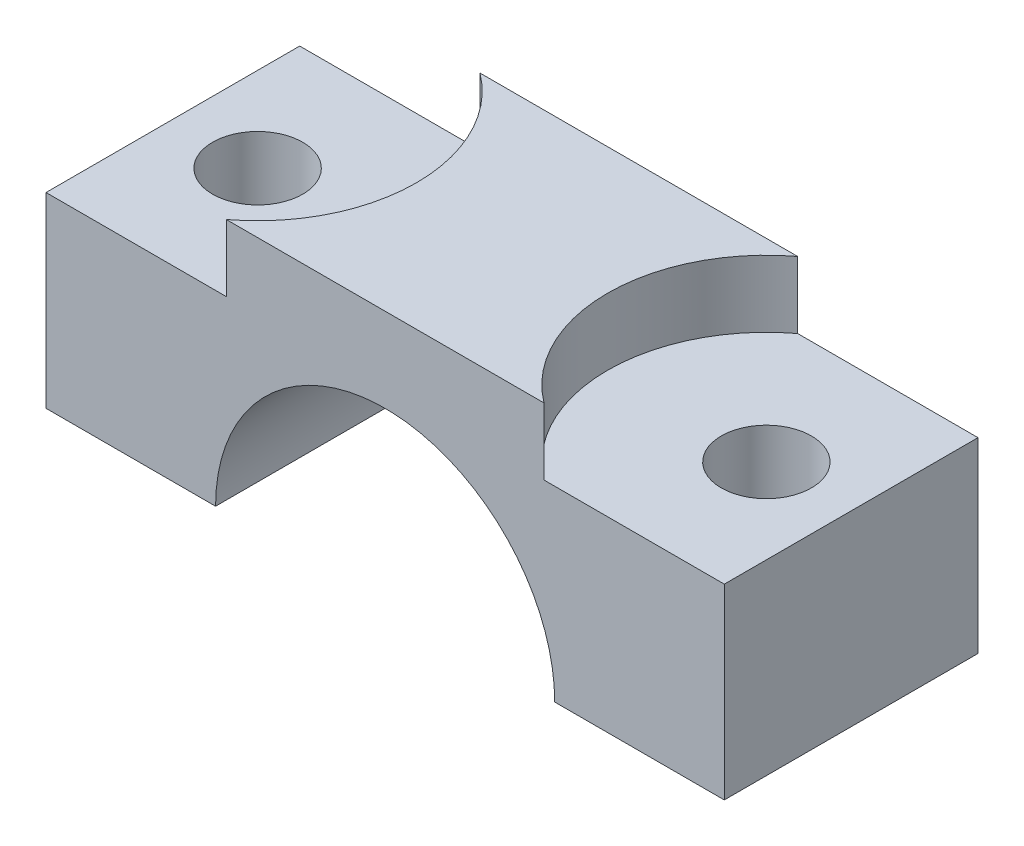
from build123d import *

# Parameters (mm, degrees)
BOSS_EXTRUDE1_DEPTH = 19
HOLE1_D             = 6.75
HOLE1_DEPTH         = 100
HOLE1_CBORE_D       = 23.785
HOLE1_CBORE_DEPTH   = 5


with BuildPart() as part:
    # Sketch1 → Boss-Extrude1 (new body)
    with BuildSketch(Plane.XY):
        with BuildLine():
            Line((12.7, 0), (25.4, 0))
            Line((25.4, 0), (25.4, 19))
            Line((25.4, 19), (-25.4, 19))
            Line((-25.4, 19), (-25.4, 0))
            Line((-25.4, 0), (-12.7, 0))
            ThreePointArc((-12.7, 0), (0, 12.7), (12.7, 0))
        make_face()
    extrude(amount=BOSS_EXTRUDE1_DEPTH)

    # Hole1
    with Locations(Plane(origin=(0, 19, 0), x_dir=(1, 0, 0), z_dir=(0, 1, 0))):
        with Locations((19.05, -9.5), (-19.05, -9.5)):
            CounterBoreHole(HOLE1_D / 2, HOLE1_CBORE_D / 2, HOLE1_CBORE_DEPTH, depth=HOLE1_DEPTH)


solid = part.part
